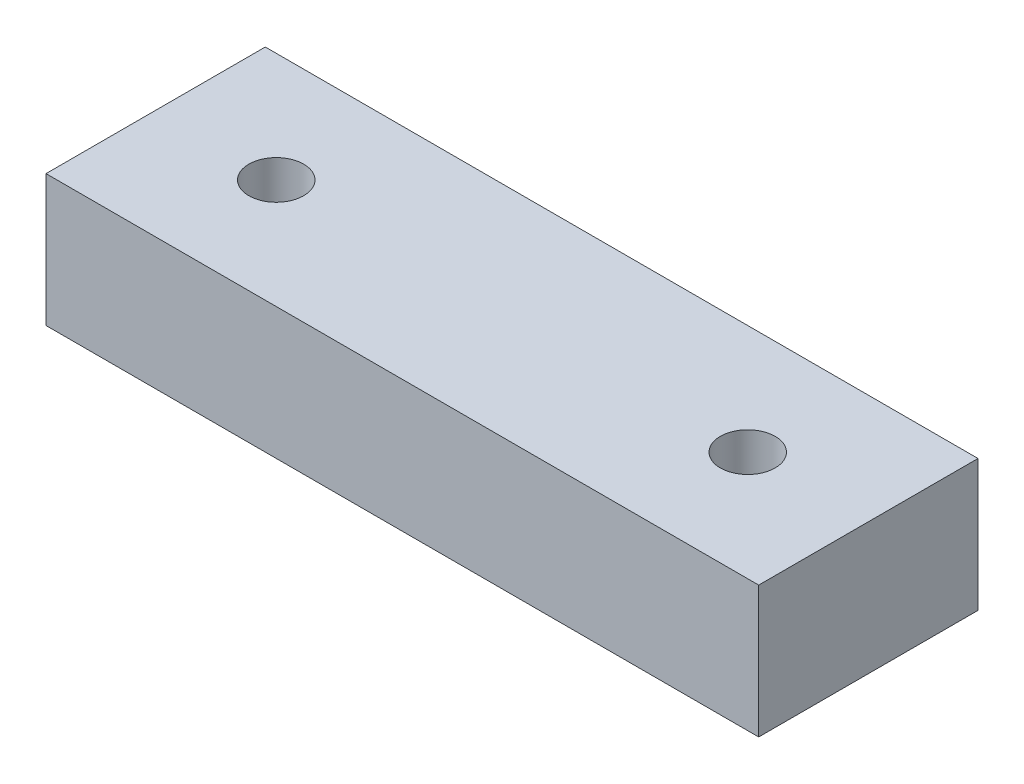
from build123d import *

# Parameters (mm, degrees)
SKETCH1_W               = 65
SKETCH1_H               = 20
BOSS_EXTRUDE1_DEPTH     = 12
CUT_EXTRUDE1_DEPTH      = 37.058979464
CUT_EXTRUDE1_DEPTH_BACK = 37.058979464
SKETCH3_R               = 2.5


with BuildPart() as part:
    # Sketch1 → Boss-Extrude1 (new body)
    with BuildSketch(Plane(origin=(0, 0, 0), x_dir=(1, 0, 0), z_dir=(0, 1, 0))):
        Rectangle(SKETCH1_W, SKETCH1_H)
    extrude(amount=BOSS_EXTRUDE1_DEPTH)

    # Sketch3 → Cut-Extrude1 (cut, two sides: drawn at the far end of the back side and taken through both)
    with BuildSketch(Plane(origin=(0, 0, 0), x_dir=(-1, 0, 0), z_dir=(0, -1, 0)).offset(-CUT_EXTRUDE1_DEPTH_BACK)):
        with Locations(Location((21.5, 0, 0), (0, 0, 90))):
            Circle(SKETCH3_R)
        with Locations(Location((-21.5, 0, 0), (0, 0, 90))):
            Circle(SKETCH3_R)
    extrude(amount=CUT_EXTRUDE1_DEPTH + CUT_EXTRUDE1_DEPTH_BACK, mode=Mode.SUBTRACT)


solid = part.part
